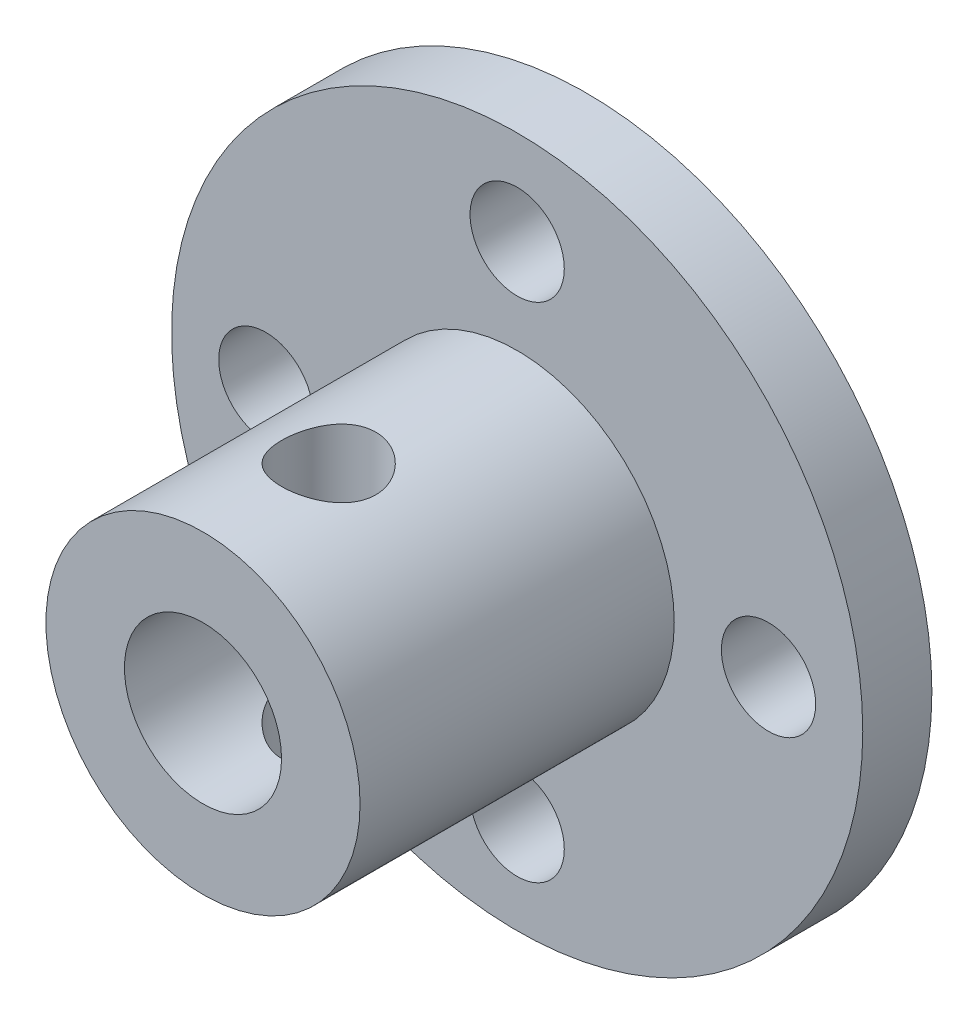
from build123d import *

# Parameters (mm, degrees)
SKETCH_1_R               = 11
SKETCH_1_R_2             = 1.5
EXTRUDE_1_DEPTH          = 2.2
SKETCH_2_R               = 5
EXTRUDE_2_DEPTH          = 10
SKETCH_3_R               = 2.5
CUT_EXTRUDE_1_DEPTH      = 20.769673745
CUT_EXTRUDE_2_DEPTH      = 20.769673745
CUT_EXTRUDE_2_DEPTH_BACK = 20.769673745


with BuildPart() as part:
    # 草图1 → 凸台-拉伸1 (new body)
    with BuildSketch(Plane.XY):
        Circle(SKETCH_1_R)
        with Locations((0, 8)):
            Circle(SKETCH_1_R_2, mode=Mode.SUBTRACT)
        with Locations((8, 0)):
            Circle(SKETCH_1_R_2, mode=Mode.SUBTRACT)
        with Locations((0, -8)):
            Circle(SKETCH_1_R_2, mode=Mode.SUBTRACT)
        with Locations((-8, 0)):
            Circle(SKETCH_1_R_2, mode=Mode.SUBTRACT)
    extrude(amount=EXTRUDE_1_DEPTH)

    # 草图2 → 凸台-拉伸2 (add)
    with BuildSketch(Plane.XY.offset(2.2)):
        Circle(SKETCH_2_R)
    extrude(amount=EXTRUDE_2_DEPTH)

    # 草图3 → 切除-拉伸1 (cut, through all)
    with BuildSketch(Plane.XY.offset(12.2)):
        Circle(SKETCH_3_R)
    extrude(amount=-CUT_EXTRUDE_1_DEPTH, mode=Mode.SUBTRACT)

    # 草图4 → 切除-拉伸2 (cut, two sides: drawn at the far end of the back side and taken through both)
    with BuildSketch(Plane(origin=(0, 0, 0), x_dir=(1, 0, 0), z_dir=(0, 1, 0)).offset(-CUT_EXTRUDE_2_DEPTH_BACK)):
        with BuildLine():
            ThreePointArc((1.5, -8.2), (1.060660172, -7.139339828), (0, -6.7))
            Line((0, -6.7), (0, -9.7))
            ThreePointArc((0, -9.7), (1.060660172, -9.260660172), (1.5, -8.2))
        make_face()
        with BuildLine():
            Line((0, -9.7), (0, -6.7))
            ThreePointArc((0, -6.7), (-1.5, -8.2), (0, -9.7))
        make_face()
    extrude(amount=CUT_EXTRUDE_2_DEPTH + CUT_EXTRUDE_2_DEPTH_BACK, mode=Mode.SUBTRACT)


solid = part.part
